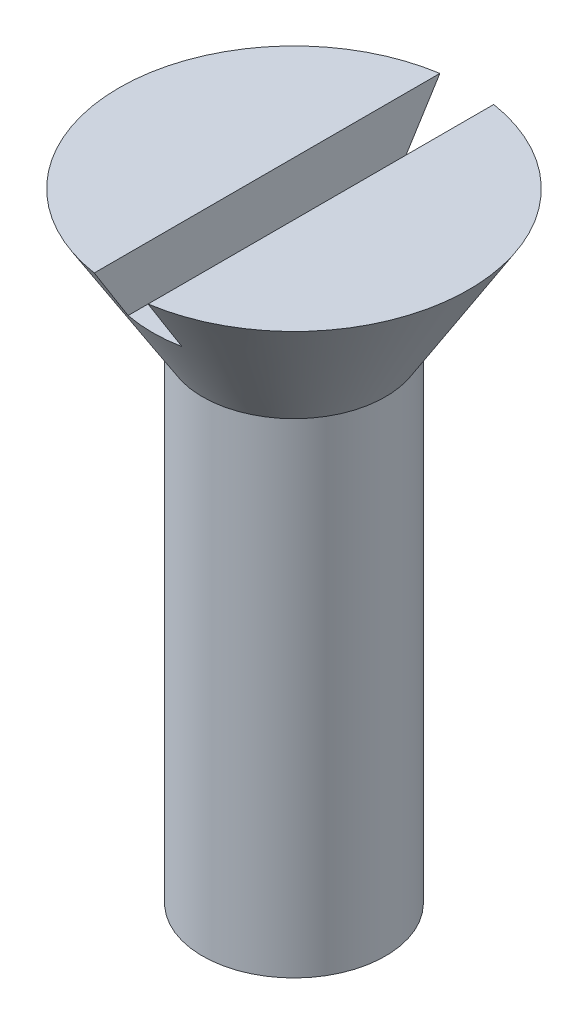
from build123d import *

# Parameters (mm, degrees)
CUT_EXTRUDE1_DEPTH      = 27.601708882
CUT_EXTRUDE1_DEPTH_BACK = 27.601708882
SKETCH2_W               = 2
SKETCH2_H               = 2


with BuildPart() as part:
    # Sketch1 → Revolve1 (revolve)
    with BuildSketch(Plane.XY):
        Polygon((-6.5, 0), (-3.4, -5), (-3.4, -23), (0, -24.962990915), (0, 0), align=None)
    revolve(axis=Axis((0, 0, 0), (0, -1, 0)))

    # Sketch2 → Cut-Extrude1 (cut, two sides: drawn at the far end of the back side and taken through both)
    with BuildSketch(Plane.XY.offset(-CUT_EXTRUDE1_DEPTH_BACK)):
        with Locations((0, -1)):
            Rectangle(SKETCH2_W, SKETCH2_H)
    extrude(amount=CUT_EXTRUDE1_DEPTH + CUT_EXTRUDE1_DEPTH_BACK, mode=Mode.SUBTRACT)


solid = part.part
